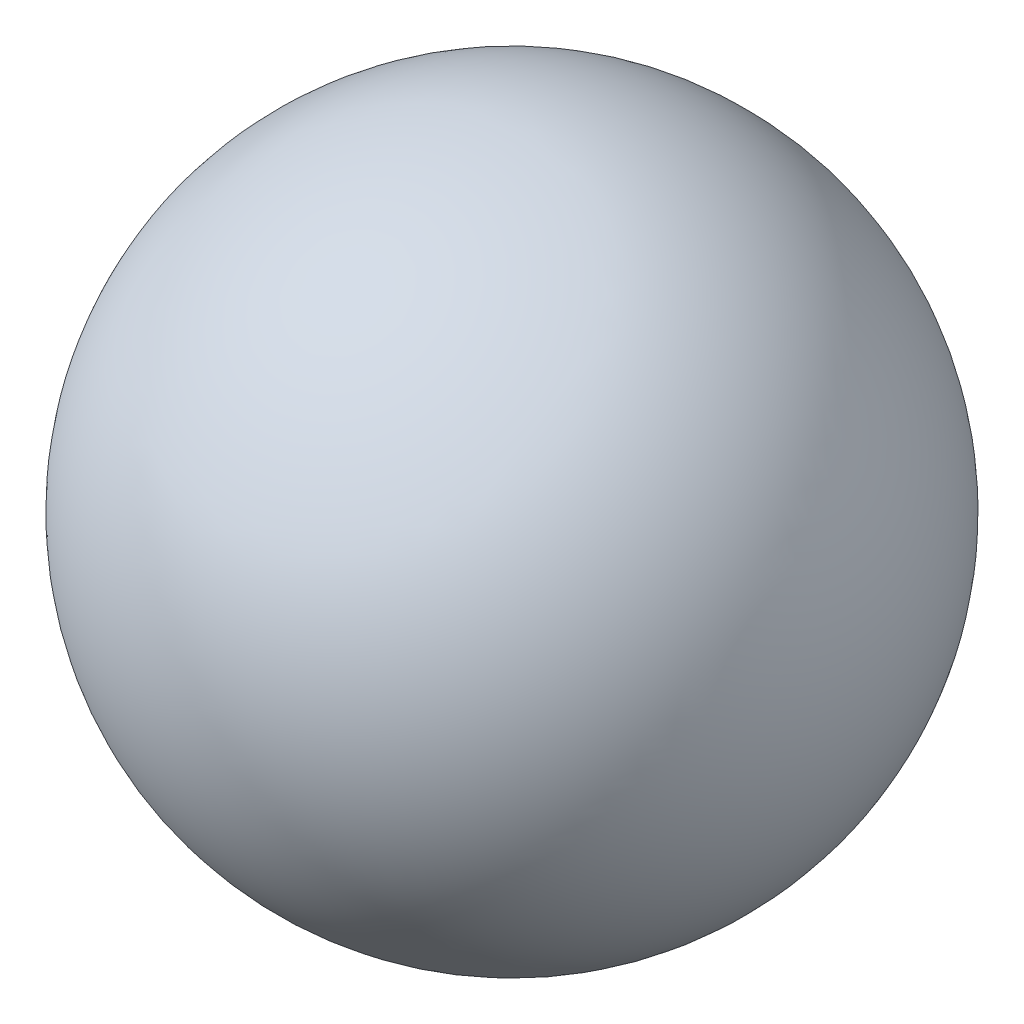
from build123d import *

# Parameters (mm, degrees)
SCALE1_SCALE = 1.9329
SCALE2_SCALE = 1.5


with BuildPart() as part:
    # Sketch1 → Revolve1 (revolve)
    with BuildSketch(Plane.XY):
        with BuildLine():
            Line((-7.5, 0), (7.5, 0))
            ThreePointArc((7.5, 0), (0, 7.5), (-7.5, 0))
        make_face()
    revolve(axis=Axis((-7.5, 0, 0), (1, 0, 0)))


with BuildPart() as part_1:
    # Scale1: scaled about (0, 0, 0)
    add(part.part.scale(SCALE1_SCALE))


with BuildPart() as part_2:
    # Scale2: scaled about (0, 0, 0)
    add(part_1.part.scale(SCALE2_SCALE))


solid = part_2.part
